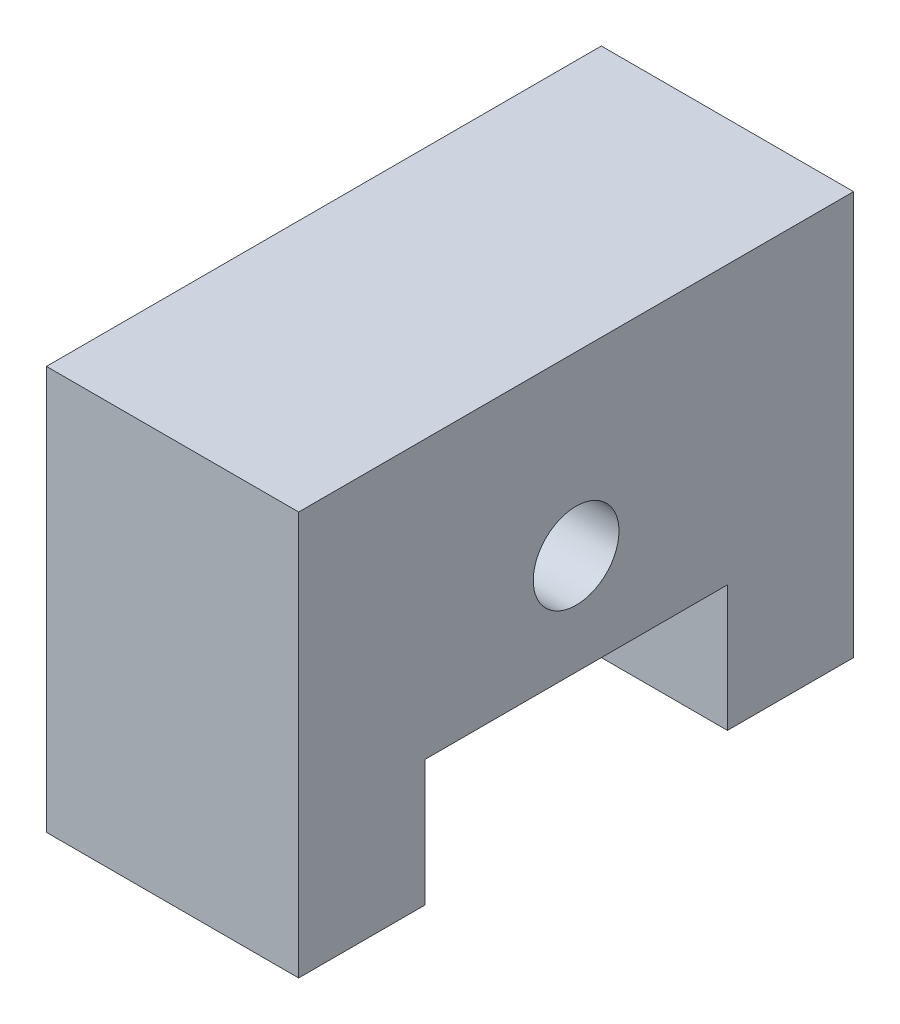
from build123d import *

# Parameters (mm, degrees)
BOSS_EXTRUDE1_DEPTH   = 10
M8_TAPPED_HOLE1_D     = 6.8
M8_TAPPED_HOLE1_DEPTH = 14
M8_TAPPED_HOLE1_TIP   = 2.042926105
M5_TAPPED_HOLE1_D     = 4.2
M5_TAPPED_HOLE1_DEPTH = 12
M5_TAPPED_HOLE1_TIP   = 1.2618073


with BuildPart() as part:
    # Sketch1 → Boss-Extrude1 (new, symmetric)
    with BuildSketch(Plane(origin=(0, 0, 0), x_dir=(0, 0, -1), z_dir=(1, 0, 0))):
        Polygon((12, 10), (-12, 10), (-12, 0), (-22, 0), (-22, 32), (22, 32), (22, 0), (12, 0), align=None)
    extrude(amount=BOSS_EXTRUDE1_DEPTH, both=True)

    # M8 Tapped Hole1
    with Locations(Plane(origin=(10, 0, 0), x_dir=(0, 0, -1), z_dir=(1, 0, 0))):
        with Locations((0, 18)):
            Hole(M8_TAPPED_HOLE1_D / 2, depth=M8_TAPPED_HOLE1_DEPTH)
            with Locations((0, 0, -(M8_TAPPED_HOLE1_DEPTH + M8_TAPPED_HOLE1_TIP / 2))):  # 118° drill point
                Cone(0, M8_TAPPED_HOLE1_D / 2, M8_TAPPED_HOLE1_TIP, mode=Mode.SUBTRACT)

    # M5 Tapped Hole1
    with Locations(Plane(origin=(0, 0, 0), x_dir=(-1, 0, 0), z_dir=(0, -1, 0))):
        with Locations((0, 17), (0, -17)):
            Hole(M5_TAPPED_HOLE1_D / 2, depth=M5_TAPPED_HOLE1_DEPTH)
            with Locations((0, 0, -(M5_TAPPED_HOLE1_DEPTH + M5_TAPPED_HOLE1_TIP / 2))):  # 118° drill point
                Cone(0, M5_TAPPED_HOLE1_D / 2, M5_TAPPED_HOLE1_TIP, mode=Mode.SUBTRACT)


solid = part.part
